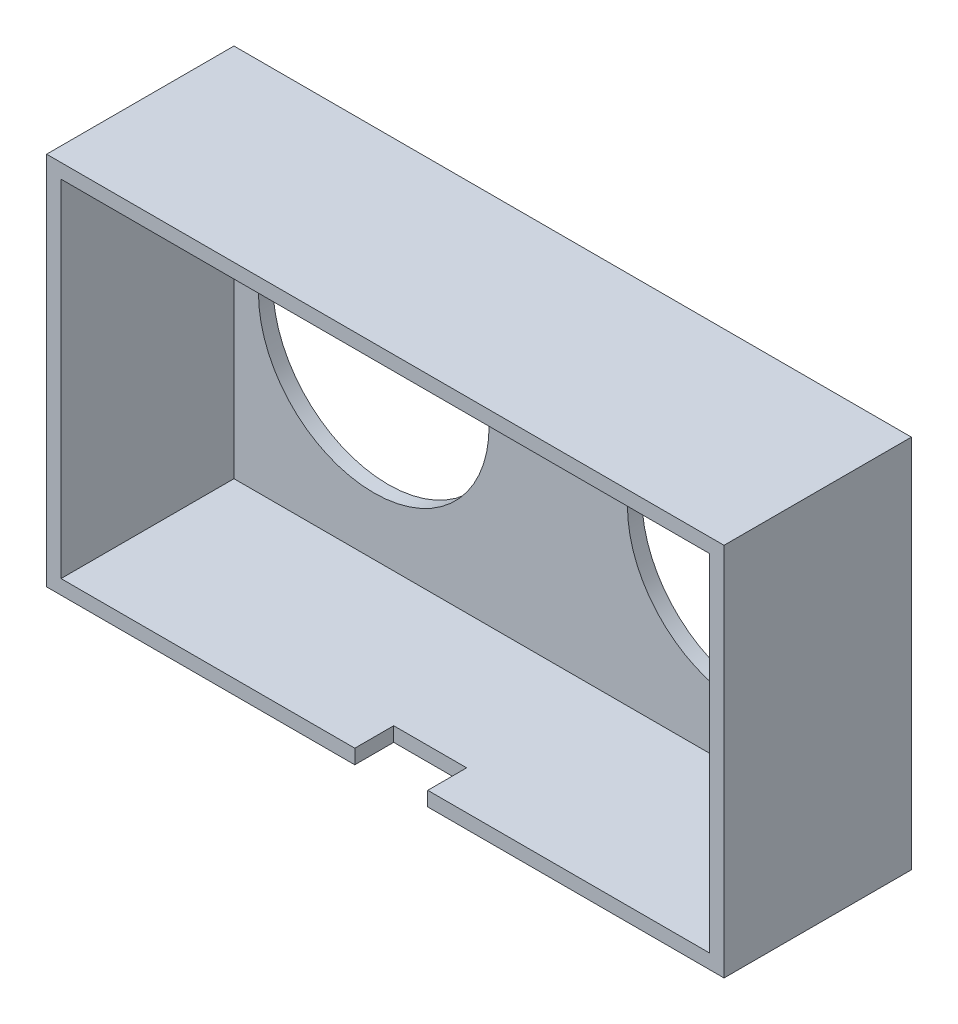
from build123d import *

# Parameters (mm, degrees)
SKETCH1_W           = 47
SKETCH1_H           = 26
SKETCH1_R           = 8
BOSS_EXTRUDE1_DEPTH = 1
SKETCH2_W           = 47
SKETCH2_H           = 26
SKETCH2_W_2         = 45
SKETCH2_H_2         = 24
BOSS_EXTRUDE2_DEPTH = 12
CUT_EXTRUDE1_REACH  = 48.505
SKETCH3_W           = 5.061855515
SKETCH3_H           = 3.126915658


with BuildPart() as part:
    # Sketch1 → Boss-Extrude1 (new body)
    with BuildSketch(Plane.XY):
        with Locations((-12.8, 0)):
            Rectangle(SKETCH1_W, SKETCH1_H)
        with Locations((-25.6, 0)):
            Circle(SKETCH1_R, mode=Mode.SUBTRACT)
        Circle(SKETCH1_R, mode=Mode.SUBTRACT)
    extrude(amount=BOSS_EXTRUDE1_DEPTH)

    # Sketch2 → Boss-Extrude2 (add)
    with BuildSketch(Plane.XY.offset(1)):
        with Locations((-12.8, 0)):
            Rectangle(SKETCH2_W, SKETCH2_H)
        with Locations((-12.8, 0)):
            Rectangle(SKETCH2_W_2, SKETCH2_H_2, mode=Mode.SUBTRACT)
    extrude(amount=BOSS_EXTRUDE2_DEPTH)

    # Sketch3 → Cut-Extrude1 (cut, up to next)
    with BuildSketch(Plane.XZ.offset(13), mode=Mode.PRIVATE) as cut_extrude1_sk1:
        with Locations((-12.387065936, 11.863457829)):
            Rectangle(SKETCH3_W, SKETCH3_H)
    cut_extrude1_tool1 = extrude(cut_extrude1_sk1.sketch, amount=-CUT_EXTRUDE1_REACH, mode=Mode.PRIVATE) & part.part
    add(cut_extrude1_tool1.solids().sort_by_distance((-12.387066, -13, 11.863458))[0], mode=Mode.SUBTRACT)


solid = part.part
